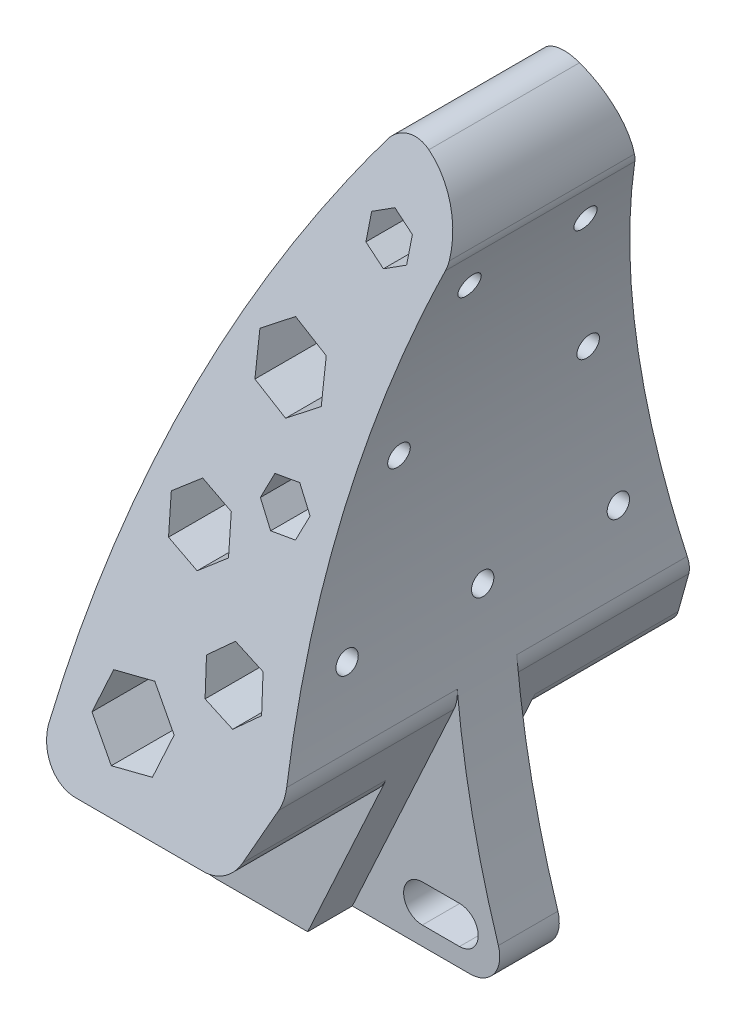
from build123d import *

# Parameters (mm, degrees)
BOSS_EXTRUDE4_DEPTH = 60
CUT_EXTRUDE2_DEPTH  = 60
SKETCH8_R           = 2.5
CUT_EXTRUDE3_DEPTH  = 60
CUT_EXTRUDE4_DEPTH  = 26
CUT_EXTRUDE5_DEPTH  = 26
SKETCH11_W          = 44.110265297
SKETCH11_H          = 23.925311971
CUT_EXTRUDE6_DEPTH  = 20
SKETCH12_W          = 40.66810553
SKETCH12_H          = 24.82561344
CUT_EXTRUDE7_DEPTH  = 20
FILLET1_R           = 5
FILLET2_R           = 5
FILLET3_R           = 5
FILLET4_R           = 5
FILLET5_R           = 5
FILLET6_R           = 5
CUT_EXTRUDE8_DEPTH  = 53
CUT_EXTRUDE9_DEPTH  = 40
CUT_EXTRUDE10_DEPTH = 40
CUT_EXTRUDE11_DEPTH = 49
SKETCH17_R          = 1.5
CUT_EXTRUDE12_DEPTH = 20
SKETCH18_R          = 1.5
CUT_EXTRUDE13_DEPTH = 20
SKETCH20_R          = 1.5
CUT_EXTRUDE14_DEPTH = 20
SKETCH21_R          = 1.5
CUT_EXTRUDE15_DEPTH = 20
SKETCH22_R          = 1.5
CUT_EXTRUDE16_DEPTH = 20
SKETCH23_R          = 1.5
CUT_EXTRUDE17_DEPTH = 15
SKETCH24_R          = 1.5
CUT_EXTRUDE18_DEPTH = 15


with BuildPart() as part:
    # Sketch5 → Boss-Extrude4 (new body)
    with BuildSketch(Plane.XY):
        with BuildLine():
            Line((-5.591433469, 0), (-33.737961989, 0))
            ThreePointArc((-33.737961989, 0), (-37.261513388, 1.45252406), (-38.737847513, 4.966165783))
            ThreePointArc((-38.737847513, 4.966165783), (-31.616240623, 53.699065918), (-10.244585549, 98.070962427))
            ThreePointArc((-10.244585549, 98.070962427), (-7.858330599, 99.704279242), (-4.994698694, 99.302347885))
            ThreePointArc((-4.994698694, 99.302347885), (-1.130402236, 95.400824643), (0.061459935, 90.040401592))
            ThreePointArc((0.061459935, 90.040401592), (-0.013962808, 89.477441364), (-0.168362399, 88.93083952))
            ThreePointArc((-0.168362399, 88.93083952), (-7.882068029, 47.204430035), (-1.77951237, 5.212129342))
            ThreePointArc((-1.77951237, 5.212129342), (-2.362771411, 1.638699232), (-5.591433469, 0))
        make_face()
        Polygon((-23.793249775, 26.029552985), (-22.148877555, 31.130017156), (-25.743822989, 35.104317357), (-30.983140641, 33.978153386), (-32.627512861, 28.877689216), (-29.032567427, 24.903389015), align=None, mode=Mode.SUBTRACT)
        Polygon((-19.704548153, 50.537737556), (-20.448711238, 55.006105989), (-24.690513357, 56.595826069), (-28.18815239, 53.717177716), (-27.443989306, 49.248809284), (-23.202187187, 47.659089203), align=None, mode=Mode.SUBTRACT)
        Polygon((-12.020901099, 69.614378519), (-12.60140651, 74.617120781), (-17.224161103, 76.615759479), (-21.266410285, 73.611655915), (-20.685904874, 68.608913653), (-16.063150281, 66.610274955), align=None, mode=Mode.SUBTRACT)
        Polygon((-4.994698694, 87.366252749), (-5.009667304, 90.521352685), (-7.749548306, 92.085939457), (-10.474460698, 90.495426291), (-10.459492087, 87.340326355), (-7.719611085, 85.775739583), align=None, mode=Mode.SUBTRACT)
        Polygon((-12.020901099, 37.637700147), (-12.875266359, 41.812019441), (-16.917515541, 43.159277068), (-20.105399463, 40.332215402), (-19.251034203, 36.157896108), (-15.208785021, 34.810638481), align=None, mode=Mode.SUBTRACT)
        Polygon((-12.020901099, 55.800966029), (-10.82059125, 58.827758896), (-12.841715841, 61.380654151), (-16.063150281, 60.906756539), (-17.263460129, 57.879963671), (-15.242335538, 55.327068416), align=None, mode=Mode.SUBTRACT)
    extrude(amount=BOSS_EXTRUDE4_DEPTH)

    # Sketch7 → Cut-Extrude2 (cut)
    with BuildSketch(Plane.XY.offset(60)):
        with BuildLine():
            Line((-12, 7.5121344), (-7, 7.5121344))
            ThreePointArc((-7, 7.5121344), (-4.4878656, 5), (-7, 2.4878656))
            Line((-7, 2.4878656), (-12, 2.4878656))
            ThreePointArc((-12, 2.4878656), (-14.5121344, 5), (-12, 7.5121344))
        make_face()
    extrude(amount=-CUT_EXTRUDE2_DEPTH, mode=Mode.SUBTRACT)

    # Sketch8 → Cut-Extrude3 (cut)
    with BuildSketch(Plane.XY.offset(60)):
        with Locations((-32.283791832, 6.170765259)):
            Circle(SKETCH8_R)
    extrude(amount=-CUT_EXTRUDE3_DEPTH, mode=Mode.SUBTRACT)

    # Sketch9 → Cut-Extrude4 (cut)
    with BuildSketch(Plane.XY):
        Polygon((0, 0), (-21.41, 0), (-7.180593074, 30.965416872), align=None)
    extrude(amount=CUT_EXTRUDE4_DEPTH, mode=Mode.SUBTRACT)

    # Sketch10 → Cut-Extrude5 (cut)
    with BuildSketch(Plane.XY.offset(60)):
        Polygon((0, 0), (-21.41, 0), (-7.180593074, 30.965416872), align=None)
    extrude(amount=-CUT_EXTRUDE5_DEPTH, mode=Mode.SUBTRACT)

    # Sketch11 → Cut-Extrude6 (cut)
    with BuildSketch(Plane.XY.offset(60)):
        with Locations((-22.055132649, 8.037344015)):
            Rectangle(SKETCH11_W, SKETCH11_H)
    extrude(amount=-CUT_EXTRUDE6_DEPTH, mode=Mode.SUBTRACT)

    # Sketch12 → Cut-Extrude7 (cut)
    with BuildSketch(Plane(origin=(0, 0, 0), x_dir=(-1, 0, 0), z_dir=(0, 0, -1))):
        with Locations((20.334052765, 7.58719328)):
            Rectangle(SKETCH12_W, SKETCH12_H)
    extrude(amount=-CUT_EXTRUDE7_DEPTH, mode=Mode.SUBTRACT)

    # Fillet1
    fillet1_edges = [part.edges().sort_by_distance(p)[0] for p in [
        (-12.219484668, 20, 50),
    ]]
    fillet(fillet1_edges, radius=FILLET1_R)

    # Fillet2
    fillet2_edges = [part.edges().sort_by_distance(p)[0] for p in [
        (-7.180593074, 30.965416872, 47),
    ]]
    fillet(fillet2_edges, radius=FILLET2_R)

    # Fillet3
    fillet3_edges = [part.edges().sort_by_distance(p)[0] for p in [
        (-12.219484668, 20, 10),
    ]]
    fillet(fillet3_edges, radius=FILLET3_R)

    # Fillet4
    fillet4_edges = [part.edges().sort_by_distance(p)[0] for p in [
        (-7.180593074, 30.965416872, 13),
    ]]
    fillet(fillet4_edges, radius=FILLET4_R)

    # Fillet5
    fillet5_edges = [part.edges().sort_by_distance(p)[0] for p in [
        (-38.144186452, 20, 10),
    ]]
    fillet(fillet5_edges, radius=FILLET5_R)

    # Fillet6
    fillet6_edges = [part.edges().sort_by_distance(p)[0] for p in [
        (-38.144186452, 20, 50),
    ]]
    fillet(fillet6_edges, radius=FILLET6_R)

    # Sketch15 → Cut-Extrude8 (cut)
    with BuildSketch(Plane(origin=(0, 0, 0), x_dir=(0, 0, -1), z_dir=(1, 0, 0))):
        Polygon((-60, 20), (-40, 99.809969504), (-60, 99.809969504), align=None)
    extrude(amount=-CUT_EXTRUDE8_DEPTH, mode=Mode.SUBTRACT)

    # Sketch15<2> → Cut-Extrude9 (cut)
    with BuildSketch(Plane(origin=(0, 0, 0), x_dir=(0, 0, -1), z_dir=(1, 0, 0))):
        Polygon((-60, 20), (-40, 99.809969504), (-60, 99.809969504), align=None)
    extrude(amount=CUT_EXTRUDE9_DEPTH, mode=Mode.SUBTRACT)

    # Sketch16 → Cut-Extrude10 (cut)
    with BuildSketch(Plane(origin=(0, 0, 0), x_dir=(0, 0, -1), z_dir=(1, 0, 0))):
        Polygon((0, 20), (0, 99.809969504), (-20, 99.809969504), align=None)
    extrude(amount=-CUT_EXTRUDE10_DEPTH, mode=Mode.SUBTRACT)

    # Sketch16<2> → Cut-Extrude11 (cut)
    with BuildSketch(Plane(origin=(0, 0, 0), x_dir=(0, 0, -1), z_dir=(1, 0, 0))):
        Polygon((0, 20), (0, 99.809969504), (-20, 99.809969504), align=None)
    extrude(amount=CUT_EXTRUDE11_DEPTH, mode=Mode.SUBTRACT)

    # Sketch17 → Cut-Extrude12 (cut)
    with BuildSketch(Plane(origin=(0, 0, 0), x_dir=(0, 0, -1), z_dir=(1, 0, 0))):
        with Locations((-48.227866977, 42.293348251)):
            Circle(SKETCH17_R)
    extrude(amount=-CUT_EXTRUDE12_DEPTH, mode=Mode.SUBTRACT)

    # Sketch18 → Cut-Extrude13 (cut)
    with BuildSketch(Plane(origin=(0, 0, 0), x_dir=(0, 0, -1), z_dir=(1, 0, 0))):
        with Locations((-11.772133023, 42.293348251)):
            Circle(SKETCH18_R)
    extrude(amount=-CUT_EXTRUDE13_DEPTH, mode=Mode.SUBTRACT)

    # Sketch20 → Cut-Extrude14 (cut)
    with BuildSketch(Plane(origin=(0, 0, 0), x_dir=(0, 0, -1), z_dir=(1, 0, 0))):
        with Locations((-30.003246604, 42.293348251)):
            Circle(SKETCH20_R)
    extrude(amount=-CUT_EXTRUDE14_DEPTH, mode=Mode.SUBTRACT)

    # Sketch21 → Cut-Extrude15 (cut)
    with BuildSketch(Plane(origin=(0, 0, 0), x_dir=(0, 0, -1), z_dir=(1, 0, 0))):
        with Locations((-42.714771273, 64.293348251)):
            Circle(SKETCH21_R)
    extrude(amount=-CUT_EXTRUDE15_DEPTH, mode=Mode.SUBTRACT)

    # Sketch22 → Cut-Extrude16 (cut)
    with BuildSketch(Plane(origin=(0, 0, 0), x_dir=(0, 0, -1), z_dir=(1, 0, 0))):
        with Locations((-17.285228727, 64.293348251)):
            Circle(SKETCH22_R)
    extrude(amount=-CUT_EXTRUDE16_DEPTH, mode=Mode.SUBTRACT)

    # Sketch23 → Cut-Extrude17 (cut)
    with BuildSketch(Plane(origin=(0, 0, 0), x_dir=(0, 0, -1), z_dir=(1, 0, 0))):
        with Locations((-37.793709057, 83.93083952)):
            Circle(SKETCH23_R)
    extrude(amount=-CUT_EXTRUDE17_DEPTH, mode=Mode.SUBTRACT)

    # Sketch24 → Cut-Extrude18 (cut)
    with BuildSketch(Plane(origin=(0, 0, 0), x_dir=(0, 0, -1), z_dir=(1, 0, 0))):
        with Locations((-22.206290943, 83.93083952)):
            Circle(SKETCH24_R)
    extrude(amount=-CUT_EXTRUDE18_DEPTH, mode=Mode.SUBTRACT)


solid = part.part
